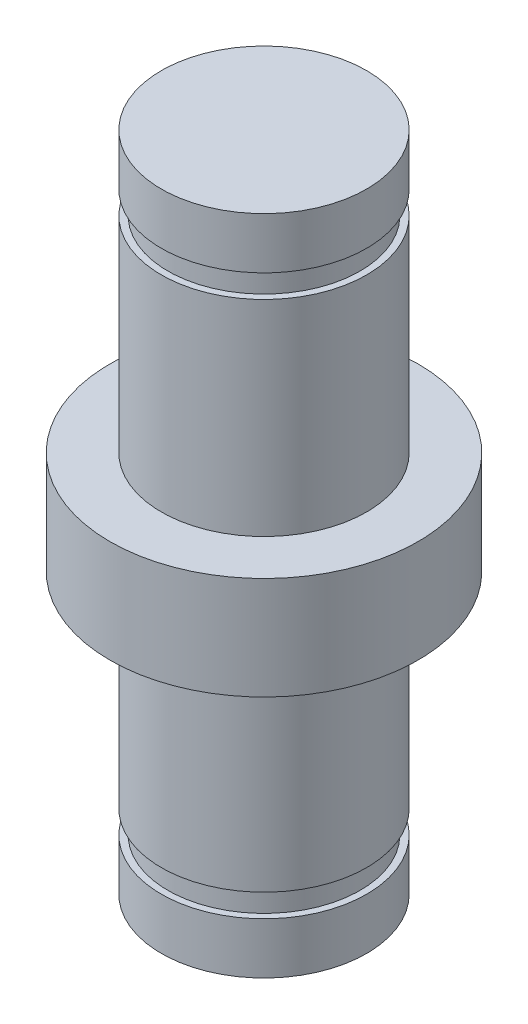
from build123d import *


with BuildPart() as part:
    # Sketch1 → Revolve1 (revolve)
    with BuildSketch(Plane.XY, mode=Mode.PRIVATE) as revolve1_sk:
        Polygon((0, 40.9448), (6.35, 40.9448), (6.35, 37.7698), (5.9436, 37.7698), (5.9436, 36.3474), (6.35, 36.3474), (6.35, 23.6474), (9.525, 23.6474), (9.525, 17.2974), (6.35, 17.2974), (6.35, 4.5974), (5.9436, 4.5974), (5.9436, 3.175), (6.35, 3.175), (6.35, 0), (0, 0), align=None)
    revolve(revolve1_sk.sketch.rotate(Axis((0, 0, 0), (0, 1, 0)), 90), axis=Axis((0, 0, 0), (0, 1, 0)))


solid = part.part
